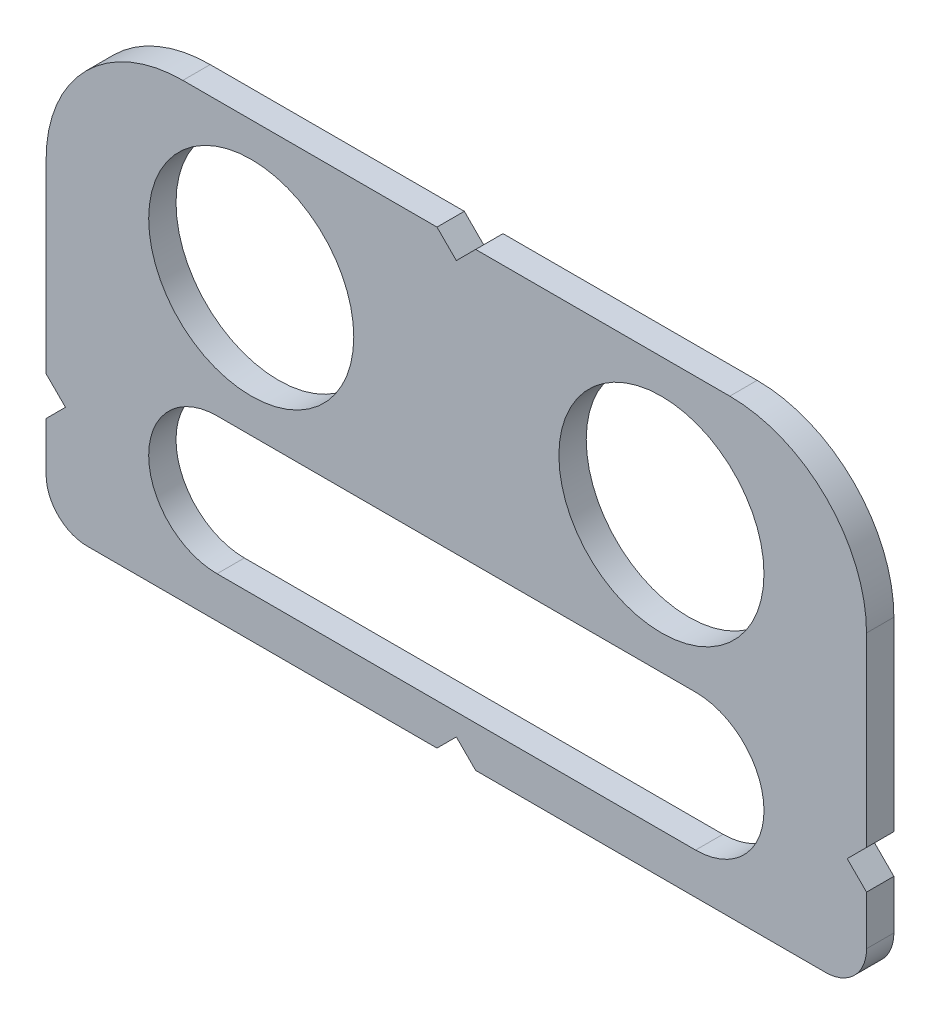
from build123d import *

# Parameters (mm, degrees)
SKETCH1_R           = 7.5
BOSS_EXTRUDE1_DEPTH = 2


with BuildPart() as part:
    # Sketch1 → Boss-Extrude1 (new body)
    with BuildSketch(Plane.XY):
        with BuildLine():
            Line((-20, 25), (-1.414213562, 25))
            Line((-1.414213562, 25), (0, 23.585786438))
            Line((0, 23.585786438), (1.414213562, 25))
            Line((1.414213562, 25), (20, 25))
            ThreePointArc((20, 25), (27.071067812, 22.071067812), (30, 15))
            Line((30, 15), (30, 1.414213562))
            Line((30, 1.414213562), (28.585786438, 0))
            Line((28.585786438, 0), (30, -1.414213562))
            Line((30, -1.414213562), (30, -5))
            ThreePointArc((30, -5), (29.121320344, -7.121320344), (27, -8))
            Line((27, -8), (1.414213562, -8))
            Line((1.414213562, -8), (0, -6.585786438))
            Line((0, -6.585786438), (-1.414213562, -8))
            Line((-1.414213562, -8), (-27, -8))
            ThreePointArc((-27, -8), (-29.121320344, -7.121320344), (-30, -5))
            Line((-30, -5), (-30, -1.414213562))
            Line((-30, -1.414213562), (-28.585786438, 0))
            Line((-28.585786438, 0), (-30, 1.414213562))
            Line((-30, 1.414213562), (-30, 15))
            ThreePointArc((-30, 15), (-27.071067812, 22.071067812), (-20, 25))
        make_face()
        with Locations((15, 15)):
            Circle(SKETCH1_R, mode=Mode.SUBTRACT)
        with Locations(Location((-15, 15, 0), (0, 0, 180))):
            Circle(SKETCH1_R, mode=Mode.SUBTRACT)
        with BuildLine():
            Line((-17.5, 5), (17.5, 5))
            ThreePointArc((17.5, 5), (22.5, 0), (17.5, -5))
            Line((17.5, -5), (-17.5, -5))
            ThreePointArc((-17.5, -5), (-22.5, 0), (-17.5, 5))
        make_face(mode=Mode.SUBTRACT)
    extrude(amount=BOSS_EXTRUDE1_DEPTH)


solid = part.part
